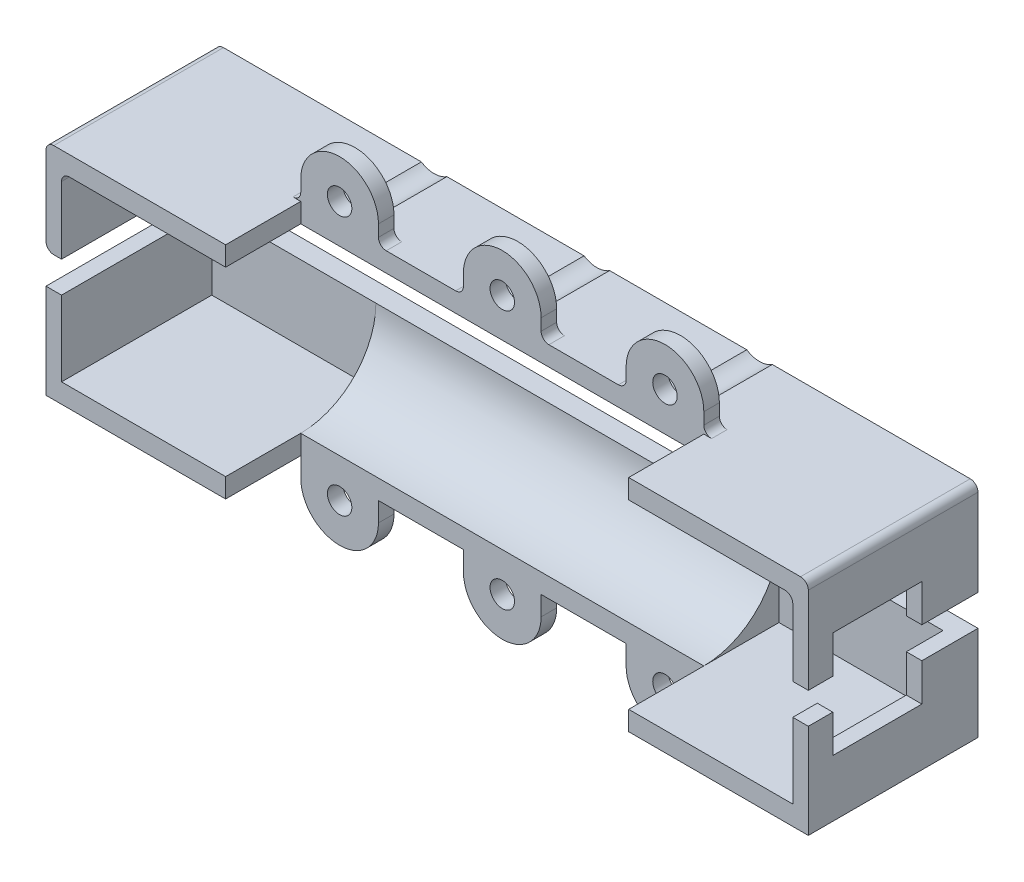
from build123d import *

# Parameters (mm, degrees)
BOSS_EXTRUDE1_DEPTH = 65.8876
BOSS_EXTRUDE2_DEPTH = 29.3624
BOSS_EXTRUDE3_DEPTH = 2.54
SKETCH4_R           = 2
BOSS_EXTRUDE4_DEPTH = 2.54
SKETCH6_W           = 24.561
SKETCH6_H           = 12.2809
BOSS_EXTRUDE5_DEPTH = 2.54
FILLET1_R           = 1.27
FILLET2_R           = 1.27
FILLET3_R           = 1.27
SKETCH7_R           = 3.80000002
CUT_EXTRUDE1_DEPTH  = 12.9159


with BuildPart() as part:
    # Sketch1 → Boss-Extrude1 (new body)
    with BuildSketch(Plane(origin=(0, 0, 0), x_dir=(0, 0, -1), z_dir=(1, 0, 0))):
        with BuildLine():
            Line((34.207401555, 10.336569156), (37.382401555, 10.336569156))
            Line((37.382401555, 10.336569156), (37.382401555, -5.119330844))
            Line((37.382401555, -5.119330844), (21.926501555, -5.119330844))
            Line((21.926501555, -5.119330844), (21.926501555, -1.944330844))
            ThreePointArc((21.926501555, -1.944330844), (30.610409224, 1.652661487), (34.207401555, 10.336569156))
        make_face()
    extrude(amount=BOSS_EXTRUDE1_DEPTH)

    # Sketch2 → Boss-Extrude2 (add)
    with BuildSketch(Plane(origin=(65.8876, 0, 0), x_dir=(0, 0, -1), z_dir=(1, 0, 0))):
        Polygon((37.382401555, -1.944330844), (37.382401555, 10.336569156), (34.207401555, 10.336569156), (34.207401555, -1.944330844), (9.646401555, -1.944330844), (9.646401555, -5.119330844), (37.382401555, -5.119330844), align=None)
    boss_extrude2 = extrude(amount=BOSS_EXTRUDE2_DEPTH)

    # Sketch3 → Boss-Extrude3 (add)
    with BuildSketch(Plane(origin=(95.25, 0, 0), x_dir=(0, 0, -1), z_dir=(1, 0, 0))):
        Polygon((28.207401555, 4.196119156), (13.646401555, 4.196119156), (13.646401555, 10.336569156), (9.646401555, 10.336569156), (9.646401555, 4.196119156), (9.646401555, -1.944330844), (28.207401555, -1.944330844), (34.207401555, -1.944330844), (34.207401555, 10.336569156), (28.207401555, 10.336569156), align=None)
    extrude(amount=-BOSS_EXTRUDE3_DEPTH)

    # Sketch4 → Boss-Extrude4 (add)
    # profile 1 of 3: a face of its own
    with BuildSketch(Plane.XY.offset(-21.926501555)):
        with BuildLine():
            Line((0, -8.294330844), (0, -5.119330844))
            Line((0, -5.119330844), (12.7, -5.119330844))
            Line((12.7, -5.119330844), (12.7, -8.294330844))
            ThreePointArc((12.7, -8.294330844), (6.35, -14.644330844), (0, -8.294330844))
        make_face()
        with Locations((6.35, -8.294330844)):
            Circle(SKETCH4_R, mode=Mode.SUBTRACT)
    # profile 2 of 3: a face of its own
    with BuildSketch(Plane.XY.offset(-21.926501555)):
        with BuildLine():
            Line((26.5938, -8.294330844), (26.5938, -5.119330844))
            Line((26.5938, -5.119330844), (39.2938, -5.119330844))
            Line((39.2938, -5.119330844), (39.2938, -8.294330844))
            ThreePointArc((39.2938, -8.294330844), (32.9438, -14.644330844), (26.5938, -8.294330844))
        make_face()
        with Locations((32.9438, -8.294330844)):
            Circle(SKETCH4_R, mode=Mode.SUBTRACT)
    # profile 3 of 3: a face of its own
    with BuildSketch(Plane.XY.offset(-21.926501555)):
        with BuildLine():
            Line((53.1876, -5.119330844), (65.8876, -5.119330844))
            Line((65.8876, -5.119330844), (65.8876, -8.294330844))
            ThreePointArc((65.8876, -8.294330844), (59.5376, -14.644330844), (53.1876, -8.294330844))
            Line((53.1876, -8.294330844), (53.1876, -5.119330844))
        make_face()
        with Locations(Location((59.5376, -8.294330844, 0), (0, 0, 180))):
            Circle(SKETCH4_R, mode=Mode.SUBTRACT)
    extrude(amount=-BOSS_EXTRUDE4_DEPTH)

    # Mirror1: Boss-Extrude2 across plane
    add(boss_extrude2.mirror(Plane(origin=(32.9438, 0, 0), x_dir=(0, 0, 1), z_dir=(1, 0, 0))))

    # Sketch6 → Boss-Extrude5 (add)
    with BuildSketch(Plane.ZY.offset(29.3624)):
        with Locations((-21.926901555, 4.196119156)):
            Rectangle(SKETCH6_W, SKETCH6_H)
    extrude(amount=-BOSS_EXTRUDE5_DEPTH)


with BuildPart() as body_2:
    # Mirror3: mirrored copy
    add(part.part.mirror(Plane.ZX.offset(12.876569156)))

    # Fillet1
    fillet1_edges = [body_2.edges().sort_by_distance(p)[0] for p in [
        (-29.3624, 30.872469156, -23.514401555),
        (-29.3624, 15.416569156, -23.514401555),
        (95.25, 30.872469156, -23.514401555),
    ]]
    fillet(fillet1_edges, radius=FILLET1_R)

    # Fillet2
    fillet2_edges = [body_2.edges().sort_by_distance(p)[0] for p in [
        (0, 30.872469156, -23.196501555),
        (12.7, 30.872469156, -23.196501555),
        (26.5938, 30.872469156, -23.196501555),
        (39.2938, 30.872469156, -23.196501555),
        (65.8876, 30.872469156, -23.196501555),
        (53.1876, 30.872469156, -23.196501555),
    ]]
    fillet(fillet2_edges, radius=FILLET2_R)

    # Fillet3
    fillet3_edges = [body_2.edges().sort_by_distance(p)[0] for p in [
        (-26.8224, 27.697469156, -21.926901555),
        (92.71, 27.697469156, -21.926901555),
    ]]
    fillet(fillet3_edges, radius=FILLET3_R)

    # Sketch7 → Cut-Extrude1 (cut)
    with BuildSketch(Plane(origin=(0, 0, -37.382401555), x_dir=(-1, 0, 0), z_dir=(0, 0, -1))):
        with Locations((-59.5376, 34.047469156)):
            Circle(SKETCH7_R)
        with Locations((-32.9438, 34.047469156)):
            Circle(SKETCH7_R)
        with Locations((-6.35, 34.047469156)):
            Circle(SKETCH7_R)
    extrude(amount=-CUT_EXTRUDE1_DEPTH, mode=Mode.SUBTRACT)


solid = Compound([part.part, body_2.part])
